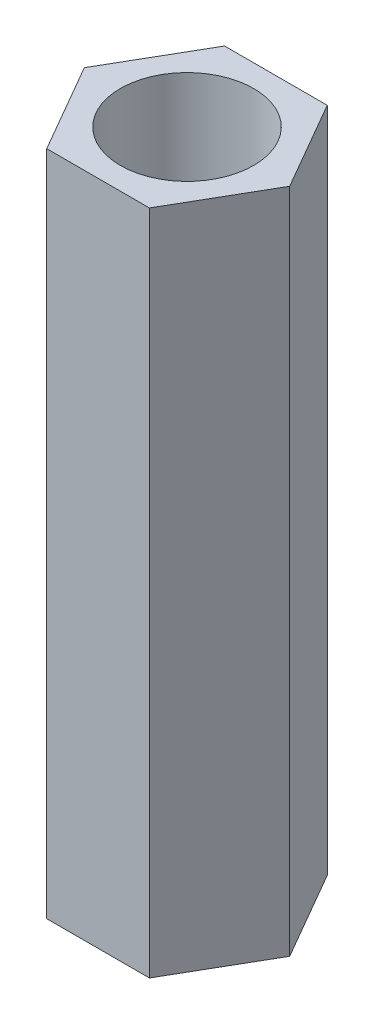
from build123d import *

# Parameters (mm, degrees)
EXTRUDE_1_DEPTH     = 15
SKETCH_2_R          = 1.5
CUT_EXTRUDE_1_DEPTH = 16.307950004


with BuildPart() as part:
    # 草图1 → 凸台-拉伸1 (new body)
    with BuildSketch(Plane(origin=(0, 0, 0), x_dir=(1, 0, 0), z_dir=(0, 1, 0))):
        Polygon((2.309401077, 0), (1.154700538, 2), (-1.154700538, 2), (-2.309401077, 0), (-1.154700538, -2), (1.154700538, -2), align=None)
    extrude(amount=EXTRUDE_1_DEPTH)

    # 草图2 → 切除-拉伸1 (cut, through all)
    with BuildSketch(Plane(origin=(0, 15, 0), x_dir=(1, 0, 0), z_dir=(0, 1, 0))):
        with Locations(Location((0, 0, 0), (0, 0, 270))):
            Circle(SKETCH_2_R)
    extrude(amount=-CUT_EXTRUDE_1_DEPTH, mode=Mode.SUBTRACT)


solid = part.part
